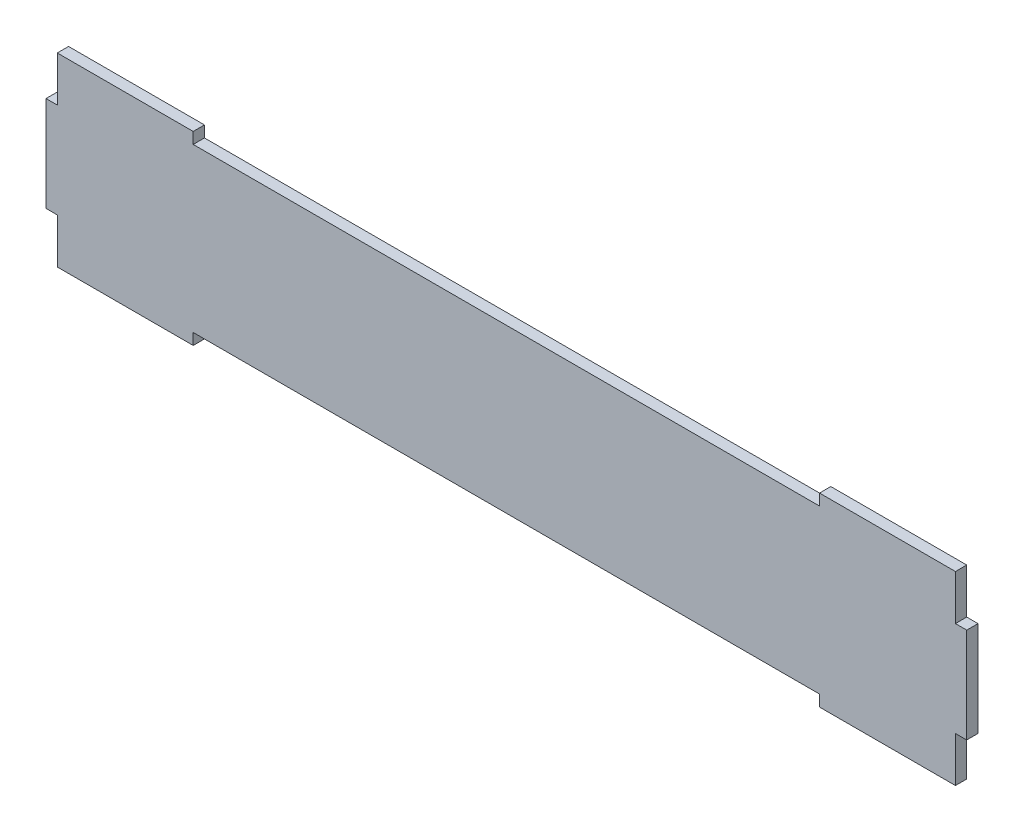
from build123d import *

# Parameters (mm, degrees)
SKETCH1_W           = 490
SKETCH1_H           = 98.65
BOSS_EXTRUDE1_DEPTH = 6
SKETCH2_W           = 6
SKETCH2_H           = 24
SKETCH2_W_2         = 333.333333334
SKETCH2_H_2         = 6
CUT_EXTRUDE1_DEPTH  = 500.867805024


with BuildPart() as part:
    # Sketch1 → Boss-Extrude1 (new body)
    with BuildSketch(Plane.XY):
        with Locations((245, 49.325)):
            Rectangle(SKETCH1_W, SKETCH1_H)
    extrude(amount=BOSS_EXTRUDE1_DEPTH)

    # Sketch2 → Cut-Extrude1 (cut, through all)
    with BuildSketch(Plane.XY.offset(6)):
        with Locations((487, 86.65)):
            Rectangle(SKETCH2_W, SKETCH2_H)
        with Locations((487, 12)):
            Rectangle(SKETCH2_W, SKETCH2_H)
        with Locations((3, 12)):
            Rectangle(SKETCH2_W, SKETCH2_H)
        with Locations((3, 86.65)):
            Rectangle(SKETCH2_W, SKETCH2_H)
        with Locations((245, 95.65)):
            Rectangle(SKETCH2_W_2, SKETCH2_H_2)
        with Locations((245, 3)):
            Rectangle(SKETCH2_W_2, SKETCH2_H_2)
    extrude(amount=-CUT_EXTRUDE1_DEPTH, mode=Mode.SUBTRACT)


solid = part.part
